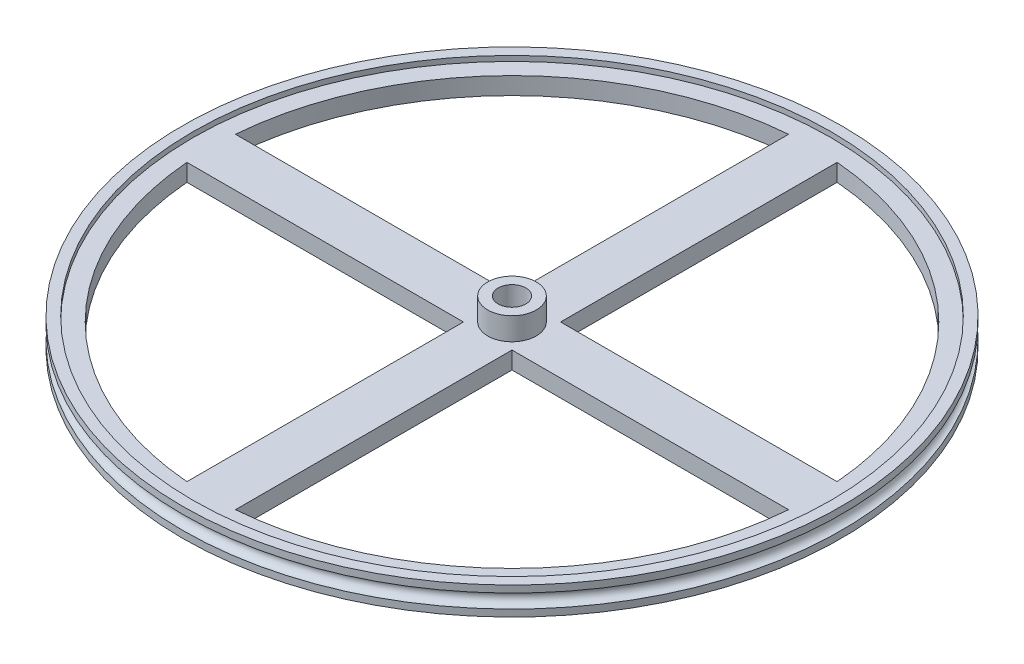
from build123d import *

# Parameters (mm, degrees)
CUT_EXTRUDE1_DEPTH = 10


with BuildPart() as part:
    # Sketch1 → Revolve2 (revolve)
    with BuildSketch(Plane.XY, mode=Mode.PRIVATE) as revolve2_sk:
        with BuildLine():
            Line((8, 8), (8, -8))
            Line((8, -8), (14, -8))
            Line((14, -8), (14, -5))
            Line((14, -5), (184, -5))
            Line((184, -5), (184, -8))
            Line((184, -8), (190, -8))
            Line((190, -8), (190, -4))
            ThreePointArc((190, -4), (186, 0), (190, 4))
            Line((190, 4), (190, 8))
            Line((190, 8), (184, 8))
            Line((184, 8), (184, 5))
            Line((184, 5), (14, 5))
            Line((14, 5), (14, 8))
            Line((14, 8), (14, 18))
            Line((14, 18), (8, 18))
            Line((8, 18), (8, 8))
        make_face()
    revolve(revolve2_sk.sketch.rotate(Axis((0, 60.317614973, 0), (0, -1, 0)), 90), axis=Axis((0, 60.317614973, 0), (0, -1, 0)))

    # Sketch2 → Cut-Extrude1 (cut)
    with BuildSketch(Plane(origin=(0, 5, 0), x_dir=(1, 0, 0), z_dir=(0, 1, 0))):
        with BuildLine():
            Line((14, 14), (14, 173.435867109))
            ThreePointArc((14, 173.435867109), (123.036579926, 123.036579926), (173.435867109, 14))
            Line((173.435867109, 14), (14, 14))
        make_face()
        with BuildLine():
            Line((-173.435867109, -14), (-14, -14))
            Line((-14, -14), (-14, -173.435867109))
            ThreePointArc((-14, -173.435867109), (-123.036579926, -123.036579926), (-173.435867109, -14))
        make_face()
        with BuildLine():
            Line((-14, 14), (-14, 173.435867109))
            ThreePointArc((-14, 173.435867109), (-123.036579926, 123.036579926), (-173.435867109, 14))
            Line((-173.435867109, 14), (-14, 14))
        make_face()
        with BuildLine():
            Line((14, -14), (173.435867109, -14))
            ThreePointArc((173.435867109, -14), (123.036579926, -123.036579926), (14, -173.435867109))
            Line((14, -173.435867109), (14, -14))
        make_face()
    extrude(amount=-CUT_EXTRUDE1_DEPTH, mode=Mode.SUBTRACT)


solid = part.part
